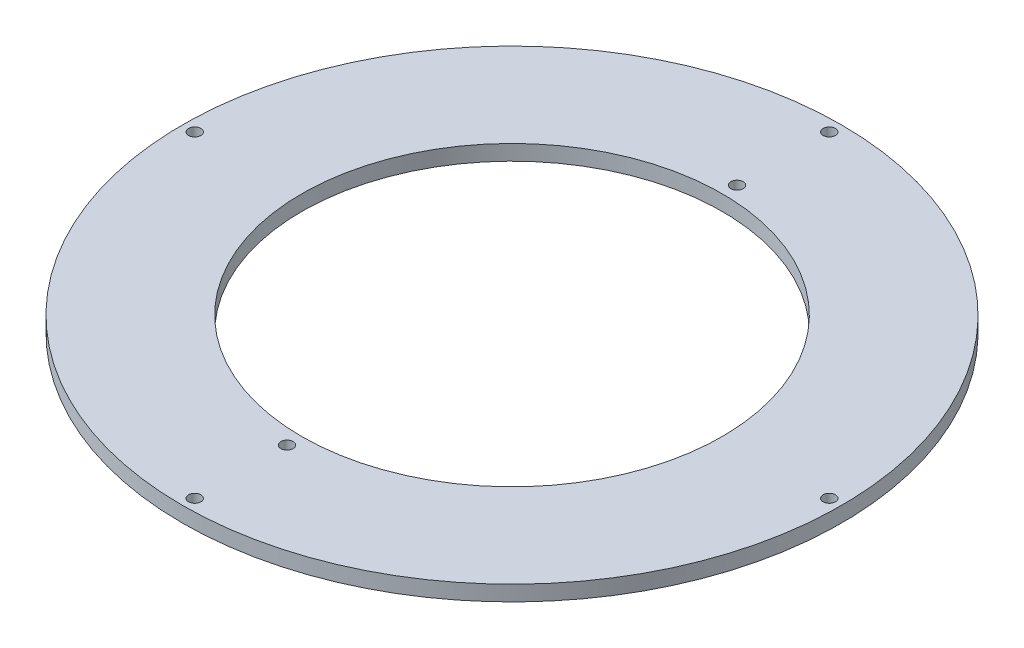
from build123d import *

# Parameters (mm, degrees)
SKETCH1_R           = 67
SKETCH1_R_2         = 42.75
BOSS_EXTRUDE1_DEPTH = 3.125
SKETCH2_R           = 1.25
CUT_EXTRUDE1_DEPTH  = 95.803827059
SKETCH3_R           = 1.25
CUT_EXTRUDE2_DEPTH  = 95.803827059


with BuildPart() as part:
    # Sketch1 → Boss-Extrude1 (new body)
    with BuildSketch(Plane(origin=(0, 0, 0), x_dir=(1, 0, 0), z_dir=(0, 1, 0))):
        with Locations(Location((0, 0, 0), (0, 0, 270))):
            Circle(SKETCH1_R)
        with Locations(Location((0, 0, 0), (0, 0, 270))):
            Circle(SKETCH1_R_2, mode=Mode.SUBTRACT)
    extrude(amount=BOSS_EXTRUDE1_DEPTH)

    # Sketch2 → Cut-Extrude1 (cut, through all)
    with BuildSketch(Plane(origin=(0, 3.125, 0), x_dir=(1, 0, 0), z_dir=(0, 1, 0))):
        with Locations(Location((64.5, 0, 0), (0, 0, 270))):
            Circle(SKETCH2_R)
        with Locations(Location((0, 64.5, 0), (0, 0, 270))):
            Circle(SKETCH2_R)
        with Locations(Location((-64.5, 0, 0), (0, 0, 270))):
            Circle(SKETCH2_R)
        with Locations(Location((0, -64.5, 0), (0, 0, 270))):
            Circle(SKETCH2_R)
    extrude(amount=-CUT_EXTRUDE1_DEPTH, mode=Mode.SUBTRACT)

    # Sketch3 → Cut-Extrude2 (cut, through all)
    with BuildSketch(Plane(origin=(0, 3.125, 0), x_dir=(1, 0, 0), z_dir=(0, 1, 0))):
        with Locations(Location((0, 45.75, 0), (0, 0, 270))):
            Circle(SKETCH3_R)
        with Locations(Location((0, -45.75, 0), (0, 0, 90))):
            Circle(SKETCH3_R)
    extrude(amount=-CUT_EXTRUDE2_DEPTH, mode=Mode.SUBTRACT)


solid = part.part
